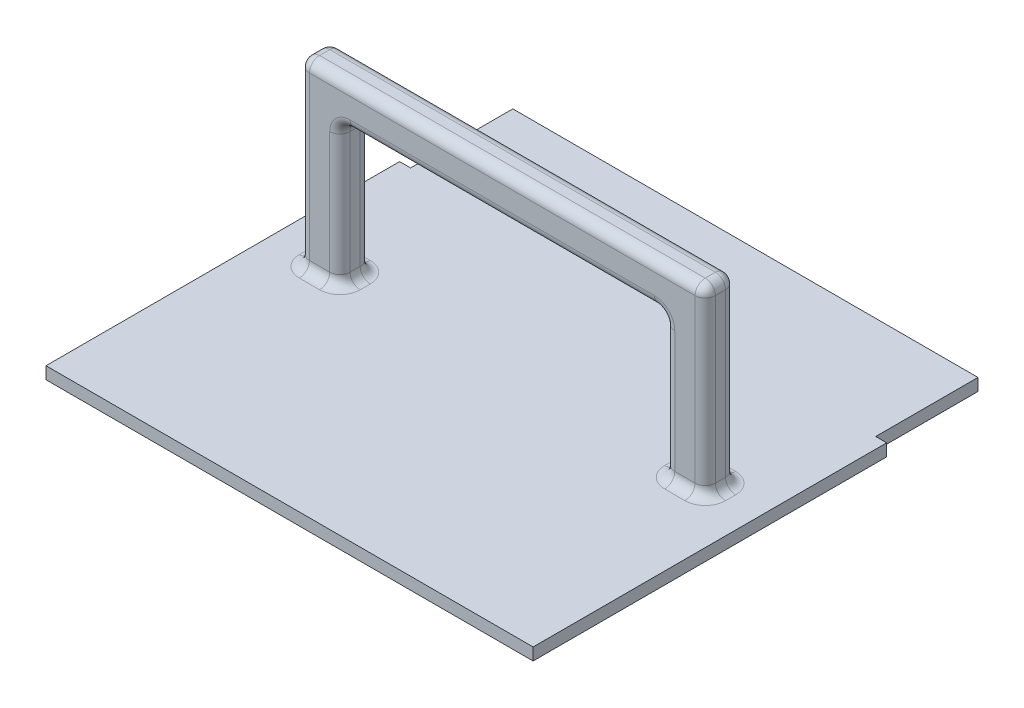
from build123d import *

# Parameters (mm, degrees)
SKETCH1_W           = 152.4
SKETCH1_H           = 142.621
BOSS_EXTRUDE1_DEPTH = 3.81
SKETCH2_W           = 127
SKETCH2_H           = 9.525
BOSS_EXTRUDE2_DEPTH = 57.15
CUT_EXTRUDE1_REACH  = 182.912
SKETCH3_W           = 101.6
SKETCH3_H           = 44.45
FILLET1_R           = 3.175
SKETCH4_W           = 3.429
SKETCH4_H           = 32.004
CUT_EXTRUDE2_DEPTH  = 217.408484448


with BuildPart() as part:
    # Sketch1 → Boss-Extrude1 (new body)
    with BuildSketch(Plane(origin=(0, 0, 0), x_dir=(1, 0, 0), z_dir=(0, 1, 0))):
        with Locations((76.2, 71.3105)):
            Rectangle(SKETCH1_W, SKETCH1_H)
    extrude(amount=BOSS_EXTRUDE1_DEPTH)

    # Sketch2 → Boss-Extrude2 (add)
    with BuildSketch(Plane(origin=(0, 3.81, 0), x_dir=(1, 0, 0), z_dir=(0, 1, 0))):
        with Locations((76.2, 71.3105)):
            Rectangle(SKETCH2_W, SKETCH2_H)
    extrude(amount=BOSS_EXTRUDE2_DEPTH)

    # Sketch3 → Cut-Extrude1 (cut, up to next)
    with BuildSketch(Plane.XY.offset(-66.548), mode=Mode.PRIVATE) as cut_extrude1_sk1:
        with Locations((76.2, 26.035)):
            Rectangle(SKETCH3_W, SKETCH3_H)
    cut_extrude1_tool1 = extrude(cut_extrude1_sk1.sketch, amount=-CUT_EXTRUDE1_REACH, mode=Mode.PRIVATE) & part.part
    add(cut_extrude1_tool1.solids().sort_by_distance((76.2, 26.035, -66.548))[0], mode=Mode.SUBTRACT)

    # Fillet1
    fillet1_edges = [part.edges().sort_by_distance(p)[0] for p in [
        (12.7, 3.81, -71.3105),
        (12.7, 32.385, -76.073),
        (19.05, 3.81, -66.548),
        (12.7, 32.385, -66.548),
        (139.7, 3.81, -71.3105),
        (139.7, 32.385, -66.548),
        (133.35, 3.81, -76.073),
        (139.7, 32.385, -76.073),
        (12.7, 60.96, -71.3105),
        (76.2, 60.96, -66.548),
        (139.7, 60.96, -71.3105),
        (76.2, 60.96, -76.073),
        (19.05, 3.81, -76.073),
        (133.35, 3.81, -66.548),
        (25.4, 26.035, -76.073),
        (76.2, 48.26, -76.073),
        (127, 26.035, -76.073),
        (25.4, 3.81, -71.3105),
        (25.4, 48.26, -71.3105),
        (127, 48.26, -71.3105),
        (127, 3.81, -71.3105),
        (25.4, 26.035, -66.548),
        (127, 26.035, -66.548),
        (76.2, 48.26, -66.548),
    ]]
    fillet(fillet1_edges, radius=FILLET1_R)

    # Sketch4 → Cut-Extrude2 (cut, through all)
    with BuildSketch(Plane(origin=(0, 3.81, 0), x_dir=(1, 0, 0), z_dir=(0, 1, 0))):
        with Locations((1.7145, 126.619)):
            Rectangle(SKETCH4_W, SKETCH4_H)
        with Locations((150.6855, 126.619)):
            Rectangle(SKETCH4_W, SKETCH4_H)
    extrude(amount=-CUT_EXTRUDE2_DEPTH, mode=Mode.SUBTRACT)


solid = part.part
